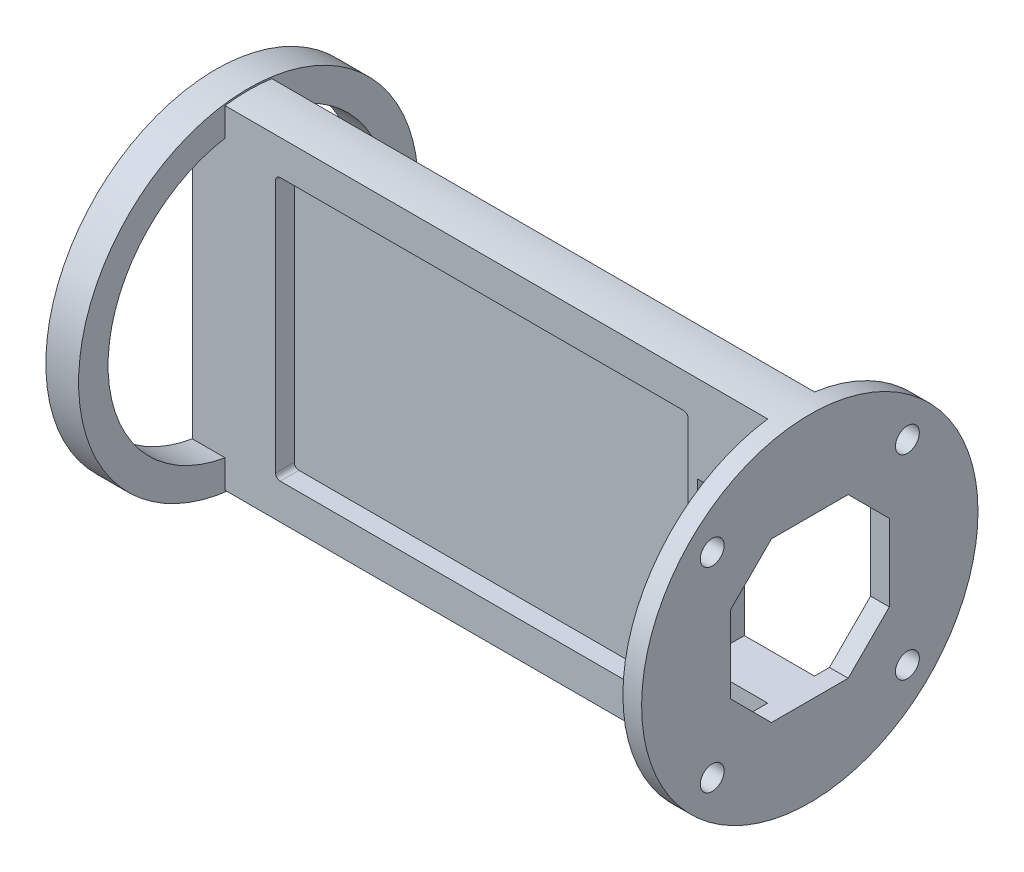
from build123d import *

# Parameters (mm, degrees)
CUT_EXTRUDE1_DEPTH      = 212.88306668
BOSS_EXTRUDE2_DEPTH     = 139.7
SKETCH9_R               = 35.95202499
BOSS_EXTRUDE3_DEPTH     = 4
CUT_EXTRUDE2_DEPTH      = 4
SKETCH11_W              = 10
SKETCH11_H              = 34
CUT_EXTRUDE3_DEPTH      = 15
RASPBERRY_PI_5_DEPTH    = 4
GPS_SLOT_DEPTH          = 5.1
SKETCH14_W              = 10
SKETCH14_H              = 16
MPU_DEPTH               = 434.220724454
ALTIMETER_DEPTH         = 434.220724454
ALTIMETER_DEPTH_BACK    = 3.54
SKETCH15_W              = 20
SKETCH15_H              = 15.34
SKETCH16_W              = 62.2
SKETCH16_H              = 25.5
PCA9685_DEPTH           = 2
SKETCH17_W              = 50
SKETCH17_H              = 27
ESP_32_1_DEPTH          = 5
SKETCH18_W              = 55
SKETCH18_H              = 30.1
BATTERY_1_DEPTH         = 3.5
SKETCH21_W              = 55
SKETCH21_H              = 30.1
BATTERY_2_DEPTH         = 3.5
SKETCH24_W              = 50
SKETCH24_H              = 27
ESP_32_MESHTASTIC_DEPTH = 5
SKETCH25_W              = 21.1
SKETCH25_H              = 43.1
STEP_DOWN_DEPTH         = 1
SKETCH26_W              = 50
SKETCH26_H              = 27
ESP_32_2_DEPTH          = 5
BOSS_EXTRUDE4_START     = -120
SKETCH27_R              = 36.3
SKETCH27_R_2            = 30
BOSS_EXTRUDE4_DEPTH     = 7
CUT_EXTRUDE4_START      = -127
SKETCH29_R              = 36.3
CUT_EXTRUDE4_DEPTH      = 226.865446219
SKETCH30_W              = 4
SKETCH30_H              = 24.4
CUT_EXTRUDE5_DEPTH      = 5.1
CUT_EXTRUDE6_REACH      = 140.027
SKETCH31_R              = 2.55


with BuildPart() as part:
    # Sketch3 → Revolve1 (revolve)
    with BuildSketch(Plane.XY):
        with BuildLine():
            Line((285.74876522, 39.710021262), (285.74876522, 3.757996272))
            Line((285.74876522, 3.757996272), (80.74876522, 3.757996272))
            Line((80.74876522, 3.757996272), (80.74876522, 19.634316044))
            add(Edge.make_bspline(
                [(80.74876522, 19.634316044), (82.347112552, 19.950400666), (85.636412123, 20.593859316), (92.311794173, 21.870421625), (109.164486257, 24.943674568), (127.867996046, 27.977765645), (146.633052135, 30.604670801), (163.733801994, 32.658467989), (174.004488004, 33.801497199), (184.284802392, 34.855212792), (194.57611333, 35.797171826), (204.876878825, 36.627240946), (213.466527777, 37.244314669), (220.34120026, 37.693162367), (227.218898943, 38.097179671), (233.238636081, 38.411453209), (238.400481516, 38.652791264), (242.701722554, 38.8352093), (246.145182192, 38.969923968), (249.584994627, 39.093417446), (253.03241088, 39.20568842), (256.467961578, 39.306735697), (259.924132141, 39.396558203), (263.346991762, 39.475154984), (266.82565511, 39.542525204), (270.211898057, 39.598668148), (273.756466178, 39.643583219), (276.60509147, 39.673059099), (279.43950326, 39.691306197), (281.597603414, 39.703938851), (283.942998009, 39.708617629), (285.03032454, 39.710021262), (285.74876522, 39.710021262)],
                knots=[0.322773044, 0.322773044, 0.322773044, 0.322773044, 0.322773044, 0.341563488, 0.3614269, 0.401153715, 0.520334158, 0.56006097, 0.579924379, 0.599787787, 0.639514601, 0.679241414, 0.699104823, 0.718968231, 0.738831638, 0.758695045, 0.778558452, 0.788490156, 0.798421859, 0.808353563, 0.818285267, 0.828216971, 0.838148675, 0.848080378, 0.858012082, 0.867943786, 0.87787549, 0.887807193, 0.897738897, 0.902704749, 0.9076706, 0.917602304, 0.917602304, 0.917602304, 0.917602304, 0.917602304], degree=4))
        make_face()
    revolve(axis=Axis((285.74876522, 3.757996272, 0), (-1, 0, 0)))

    # Sketch6 → Cut-Extrude1 (cut, through all)
    with BuildSketch(Plane(origin=(285.74876522, 0, 0), x_dir=(0, 0, -1), z_dir=(1, 0, 0))):
        with BuildLine():
            Line((-5, -31.844645496), (-5, 39.36063804))
            ThreePointArc((-5, 39.360638041), (-35.95202499, 3.757996272), (-5, -31.844645496))
        make_face()
        with BuildLine():
            ThreePointArc((35.95202499, 3.757996272), (27.132160123, 27.346001444), (5, 39.36063804))
            Line((5, 39.36063804), (5, -31.844645496))
            ThreePointArc((5, -31.844645496), (27.132160123, -19.830008899), (35.95202499, 3.757996272))
        make_face()
    extrude(amount=-CUT_EXTRUDE1_DEPTH, mode=Mode.SUBTRACT)

    # Sketch8 → Boss-Extrude2 (add)
    with BuildSketch(Plane(origin=(285.74876522, 0, 0), x_dir=(0, 0, -1), z_dir=(1, 0, 0))):
        with BuildLine():
            Line((5, -31.844645496), (5, 39.360638041))
            ThreePointArc((5, 39.360638041), (0, 39.710021262), (-5, 39.360638041))
            Line((-5, 39.360638041), (-5, -31.844645496))
            ThreePointArc((-5, -31.844645496), (0, -32.194028718), (5, -31.844645496))
        make_face()
    extrude(amount=BOSS_EXTRUDE2_DEPTH)

    # Sketch9 → Boss-Extrude3 (add)
    with BuildSketch(Plane(origin=(425.44876522, 0, 0), x_dir=(0, 0, -1), z_dir=(1, 0, 0))):
        with Locations(Location((0, 3.757996272, 0), (0, 0, 262.00572083))):
            Circle(SKETCH9_R)
    extrude(amount=BOSS_EXTRUDE3_DEPTH)

    # Sketch10 → Cut-Extrude2 (cut)
    with BuildSketch(Plane(origin=(429.44876522, 0, 0), x_dir=(0, 0, -1), z_dir=(1, 0, 0))):
        Polygon((-17, -4.442003728), (-17, 11.957996272), (-8.2, 20.757996272), (8.2, 20.757996272), (17, 11.957996272), (17, -4.442003728), (8.2, -13.242003728), (-8.2, -13.242003728), align=None)
    extrude(amount=-CUT_EXTRUDE2_DEPTH, mode=Mode.SUBTRACT)

    # Sketch11 → Cut-Extrude3 (cut)
    with BuildSketch(Plane(origin=(425.44876522, 0, 0), x_dir=(0, 0, -1), z_dir=(1, 0, 0))):
        with Locations((0, 3.757996272)):
            Rectangle(SKETCH11_W, SKETCH11_H)
    extrude(amount=-CUT_EXTRUDE3_DEPTH, mode=Mode.SUBTRACT)

    # Sketch12 → Raspberry Pi 5 (cut)
    with BuildSketch(Plane.XY.offset(5)):
        with BuildLine():
            Line((407.44876522, -24.255570554), (321.24876522, -24.255570554))
            ThreePointArc((321.24876522, -24.255570554), (320.541658439, -23.962677335), (320.24876522, -23.255570554))
            Line((320.24876522, -23.255570554), (320.24876522, 30.944429446))
            ThreePointArc((320.24876522, 30.944429446), (320.541658439, 31.651536227), (321.24876522, 31.944429446))
            Line((321.24876522, 31.944429446), (407.44876522, 31.944429446))
            ThreePointArc((407.44876522, 31.944429446), (408.155872001, 31.651536227), (408.44876522, 30.944429446))
            Line((408.44876522, 30.944429446), (408.44876522, -23.255570554))
            ThreePointArc((408.44876522, -23.255570554), (408.155872001, -23.962677335), (407.44876522, -24.255570554))
        make_face()
    extrude(amount=-RASPBERRY_PI_5_DEPTH, mode=Mode.SUBTRACT)

    # Sketch13 → GPS Slot (cut)
    with BuildSketch(Plane.XY.offset(5)):
        with BuildLine():
            Line((294.985699539, 8.990821657), (262.335699539, 8.990821657))
            ThreePointArc((262.335699539, 8.990821657), (261.628592757, 9.283714876), (261.335699539, 9.990821657))
            Line((261.335699539, 9.990821657), (261.335699539, 33.590821657))
            ThreePointArc((261.335699539, 33.590821657), (261.628592757, 34.297928438), (262.335699539, 34.590821657))
            Line((262.335699539, 34.590821657), (294.985699539, 34.590821657))
            ThreePointArc((294.985699539, 34.590821657), (295.69280632, 34.297928438), (295.985699539, 33.590821657))
            Line((295.985699539, 33.590821657), (295.985699539, 9.990821657))
            ThreePointArc((295.985699539, 9.990821657), (295.69280632, 9.283714876), (294.985699539, 8.990821657))
        make_face()
    extrude(amount=-GPS_SLOT_DEPTH, mode=Mode.SUBTRACT)

    # Sketch14 → MPU (cut, through all)
    with BuildSketch(Plane.XY.offset(5)):
        with Locations((277.879699021, -20.106936119)):
            Rectangle(SKETCH14_W, SKETCH14_H)
    extrude(amount=-MPU_DEPTH, mode=Mode.SUBTRACT)

    # Sketch15 → Altimeter (cut, two sides: drawn at the far end of the back side and taken through both)
    with BuildSketch(Plane.XY.offset(5).offset(-ALTIMETER_DEPTH_BACK)):
        with Locations((285.717294066, -1.841089471)):
            Rectangle(SKETCH15_W, SKETCH15_H)
    extrude(amount=ALTIMETER_DEPTH + ALTIMETER_DEPTH_BACK, mode=Mode.SUBTRACT)

    # Sketch16 → PCA9685 (cut)
    with BuildSketch(Plane.XY.offset(5)):
        with Locations((132.808150825, 3.59036767)):
            Rectangle(SKETCH16_W, SKETCH16_H)
    extrude(amount=-PCA9685_DEPTH, mode=Mode.SUBTRACT)

    # Sketch17 → ESP-32 (1) (cut)
    with BuildSketch(Plane.XY.offset(5)):
        with Locations((233.402571461, -10.513286129)):
            Rectangle(SKETCH17_W, SKETCH17_H)
    extrude(amount=-ESP_32_1_DEPTH, mode=Mode.SUBTRACT)

    # Sketch18 → Battery 1 (cut)
    with BuildSketch(Plane(origin=(0, 0, -5), x_dir=(-1, 0, 0), z_dir=(0, 0, -1))):
        with Locations((-377.94876522, 19.967269146)):
            Rectangle(SKETCH18_W, SKETCH18_H)
    extrude(amount=-BATTERY_1_DEPTH, mode=Mode.SUBTRACT)

    # Sketch21 → Battery 2 (cut)
    with BuildSketch(Plane(origin=(0, 0, -5), x_dir=(-1, 0, 0), z_dir=(0, 0, -1))):
        with Locations((-377.94876522, -12.451276601)):
            Rectangle(SKETCH21_W, SKETCH21_H)
    extrude(amount=-BATTERY_2_DEPTH, mode=Mode.SUBTRACT)

    # Sketch24 → ESP-32 (Meshtastic) (cut)
    with BuildSketch(Plane(origin=(0, 0, -5), x_dir=(-1, 0, 0), z_dir=(0, 0, -1))):
        with Locations((-233.841762832, 18.555689361)):
            Rectangle(SKETCH24_W, SKETCH24_H)
    extrude(amount=-ESP_32_MESHTASTIC_DEPTH, mode=Mode.SUBTRACT)

    # Sketch25 → Step Down (cut)
    with BuildSketch(Plane(origin=(0, 0, -5), x_dir=(-1, 0, 0), z_dir=(0, 0, -1))):
        with Locations((-323.977591294, 5.876880331)):
            Rectangle(SKETCH25_W, SKETCH25_H)
    extrude(amount=-STEP_DOWN_DEPTH, mode=Mode.SUBTRACT)

    # Sketch26 → ESP-32 (2) (cut)
    with BuildSketch(Plane(origin=(0, 0, -5), x_dir=(-1, 0, 0), z_dir=(0, 0, -1))):
        with Locations((-165.478674332, 3.198326217)):
            Rectangle(SKETCH26_W, SKETCH26_H)
    extrude(amount=-ESP_32_2_DEPTH, mode=Mode.SUBTRACT)

    # Sketch27 → Boss-Extrude4 (add)
    with BuildSketch(Plane(origin=(429.44876522, 0, 0), x_dir=(0, 0, -1), z_dir=(1, 0, 0)).offset(BOSS_EXTRUDE4_START)):
        with Locations((0, 3.757996272)):
            Circle(SKETCH27_R)
        with Locations((0, 3.757996272)):
            Circle(SKETCH27_R_2, mode=Mode.SUBTRACT)
    extrude(amount=-BOSS_EXTRUDE4_DEPTH)

    # Sketch29 → Cut-Extrude4 (cut, through all)
    with BuildSketch(Plane(origin=(429.44876522, 0, 0), x_dir=(0, 0, -1), z_dir=(1, 0, 0)).offset(CUT_EXTRUDE4_START)):
        with Locations((0, 3.757996272)):
            Circle(SKETCH29_R)
    extrude(amount=-CUT_EXTRUDE4_DEPTH, mode=Mode.SUBTRACT)

    # Sketch30 → Cut-Extrude5 (cut)
    with BuildSketch(Plane.ZY.offset(-302.44876522)):
        with Locations((0, 3.757996272)):
            Rectangle(SKETCH30_W, SKETCH30_H)
    extrude(amount=-CUT_EXTRUDE5_DEPTH, mode=Mode.SUBTRACT)

    # Sketch31 → Cut-Extrude6 (cut, up to next)
    with BuildSketch(Plane(origin=(429.44876522, 0, 0), x_dir=(0, 0, -1), z_dir=(1, 0, 0)), mode=Mode.PRIVATE) as cut_extrude6_sk1:
        with Locations((20.859650045, 24.617646317)):
            Circle(SKETCH31_R)
    cut_extrude6_tool1 = extrude(cut_extrude6_sk1.sketch, amount=-CUT_EXTRUDE6_REACH, mode=Mode.PRIVATE) & part.part
    # Sketch31 → Cut-Extrude6 (cut, up to next)
    with BuildSketch(Plane(origin=(429.44876522, 0, 0), x_dir=(0, 0, -1), z_dir=(1, 0, 0)), mode=Mode.PRIVATE) as cut_extrude6_sk2:
        with Locations((-20.859650045, 24.617646317)):
            Circle(SKETCH31_R)
    cut_extrude6_tool2 = extrude(cut_extrude6_sk2.sketch, amount=-CUT_EXTRUDE6_REACH, mode=Mode.PRIVATE) & part.part
    # Sketch31 → Cut-Extrude6 (cut, up to next)
    with BuildSketch(Plane(origin=(429.44876522, 0, 0), x_dir=(0, 0, -1), z_dir=(1, 0, 0)), mode=Mode.PRIVATE) as cut_extrude6_sk3:
        with Locations((-20.859650045, -17.101653773)):
            Circle(SKETCH31_R)
    cut_extrude6_tool3 = extrude(cut_extrude6_sk3.sketch, amount=-CUT_EXTRUDE6_REACH, mode=Mode.PRIVATE) & part.part
    # Sketch31 → Cut-Extrude6 (cut, up to next)
    with BuildSketch(Plane(origin=(429.44876522, 0, 0), x_dir=(0, 0, -1), z_dir=(1, 0, 0)), mode=Mode.PRIVATE) as cut_extrude6_sk4:
        with Locations((20.859650045, -17.101653773)):
            Circle(SKETCH31_R)
    cut_extrude6_tool4 = extrude(cut_extrude6_sk4.sketch, amount=-CUT_EXTRUDE6_REACH, mode=Mode.PRIVATE) & part.part
    add(cut_extrude6_tool1.solids().sort_by_distance((429.448765, 24.617646, -20.85965))[0], mode=Mode.SUBTRACT)
    add(cut_extrude6_tool2.solids().sort_by_distance((429.448765, 24.617646, 20.85965))[0], mode=Mode.SUBTRACT)
    add(cut_extrude6_tool3.solids().sort_by_distance((429.448765, -17.101654, 20.85965))[0], mode=Mode.SUBTRACT)
    add(cut_extrude6_tool4.solids().sort_by_distance((429.448765, -17.101654, -20.85965))[0], mode=Mode.SUBTRACT)


solid = part.part
